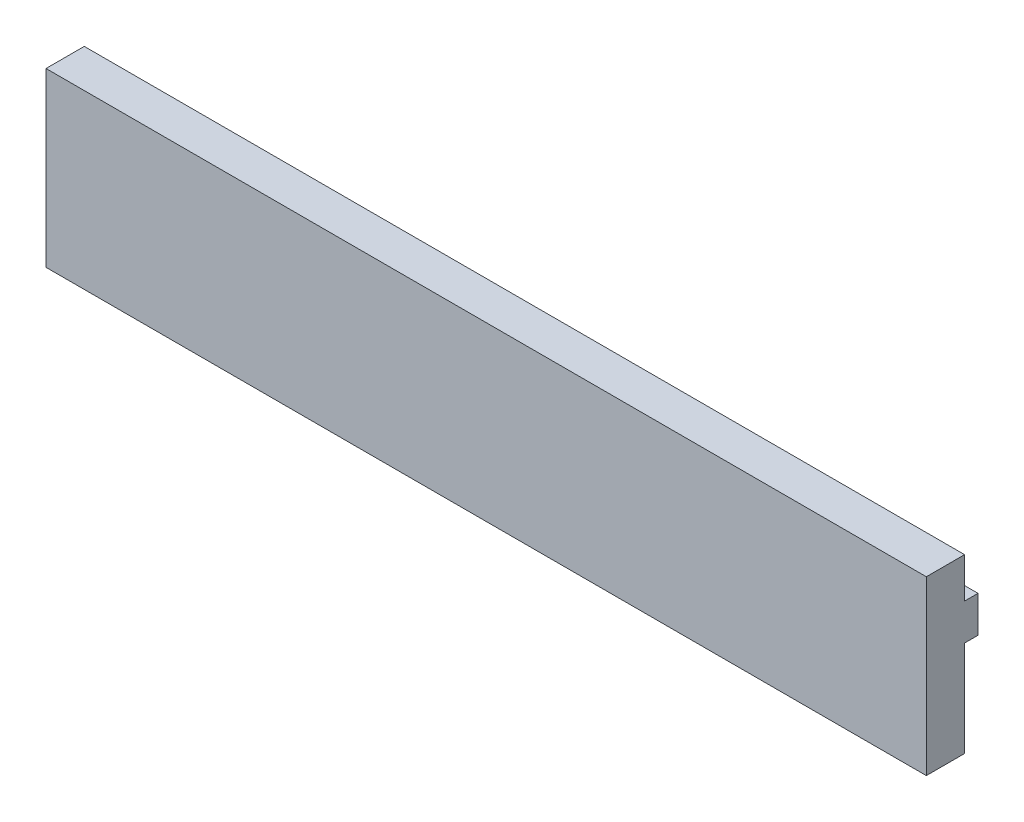
from build123d import *

# Parameters (mm, degrees)
CROQUIS1_W              = 460
CROQUIS1_H              = 90
SALIENTE_EXTRUIR1_DEPTH = 20
CROQUIS3_W              = 460
CROQUIS3_H              = 19
SALIENTE_EXTRUIR3_DEPTH = 7


with BuildPart() as part:
    # Croquis1 → Saliente-Extruir1 (new body)
    with BuildSketch(Plane.XY):
        Rectangle(CROQUIS1_W, CROQUIS1_H)
    extrude(amount=SALIENTE_EXTRUIR1_DEPTH)

    # Croquis3 → Saliente-Extruir3 (add)
    with BuildSketch(Plane(origin=(0, 0, 0), x_dir=(-1, 0, 0), z_dir=(0, 0, -1))):
        with Locations((0, 14.5)):
            Rectangle(CROQUIS3_W, CROQUIS3_H)
    extrude(amount=SALIENTE_EXTRUIR3_DEPTH)


solid = part.part
